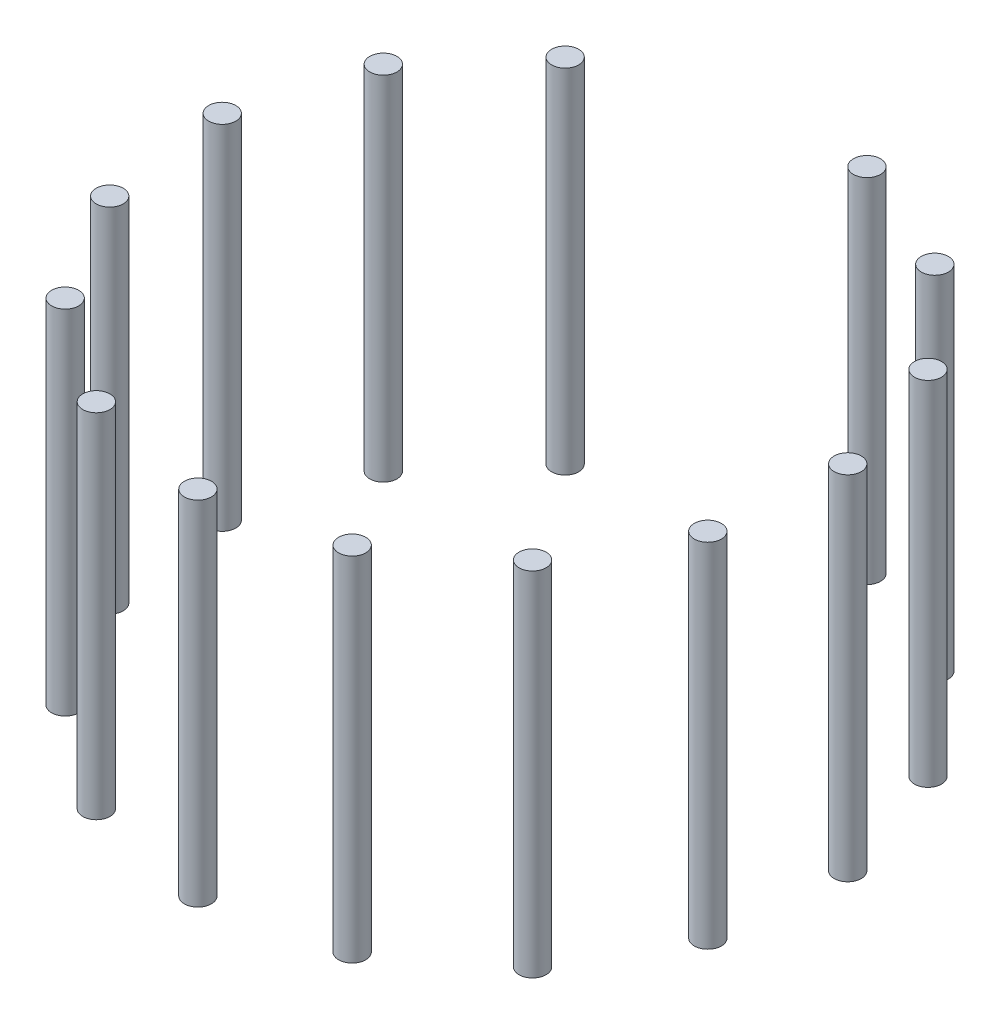
from build123d import *

# Parameters (mm, degrees)
SKETCH1_R              = 0.35
BOSS_EXTRUDE1_DEPTH    = 9.1
BOSS_EXTRUDE1_2_DEPTH  = 9.1
BOSS_EXTRUDE1_3_DEPTH  = 9.1
BOSS_EXTRUDE1_4_DEPTH  = 9.1
BOSS_EXTRUDE1_5_DEPTH  = 9.1
BOSS_EXTRUDE1_6_DEPTH  = 9.1
BOSS_EXTRUDE1_7_DEPTH  = 9.1
BOSS_EXTRUDE1_8_DEPTH  = 9.1
BOSS_EXTRUDE1_9_DEPTH  = 9.1
BOSS_EXTRUDE1_10_DEPTH = 9.1
BOSS_EXTRUDE1_11_DEPTH = 9.1
BOSS_EXTRUDE1_12_DEPTH = 9.1
BOSS_EXTRUDE1_13_DEPTH = 9.1
BOSS_EXTRUDE1_14_DEPTH = 9.1


with BuildPart() as part:
    # Sketch1 → Boss-Extrude1 (new body)
    with BuildSketch(Plane(origin=(0, 0, 0), x_dir=(1, 0, 0), z_dir=(0, 1, 0))):
        with Locations(Location((14.989749072, 9.164731075, 0), (0, 0, 270))):
            Circle(SKETCH1_R)
    extrude(amount=BOSS_EXTRUDE1_DEPTH)


with BuildPart() as body_2:
    # Sketch1 → Boss-Extrude1 2 (new body)
    with BuildSketch(Plane(origin=(0, 0, 0), x_dir=(1, 0, 0), z_dir=(0, 1, 0))):
        with Locations(Location((18.048638255, 7.857299093, 0), (0, 0, 270))):
            Circle(SKETCH1_R)
    extrude(amount=BOSS_EXTRUDE1_2_DEPTH)


with BuildPart() as body_3:
    # Sketch1 → Boss-Extrude1 3 (new body)
    with BuildSketch(Plane(origin=(0, 0, 0), x_dir=(1, 0, 0), z_dir=(0, 1, 0))):
        with Locations(Location((20.311292078, 5.418738227, 0), (0, 0, 270))):
            Circle(SKETCH1_R)
    extrude(amount=BOSS_EXTRUDE1_3_DEPTH)


with BuildPart() as body_4:
    # Sketch1 → Boss-Extrude1 4 (new body)
    with BuildSketch(Plane(origin=(0, 0, 0), x_dir=(1, 0, 0), z_dir=(0, 1, 0))):
        with Locations(Location((21.38647714, 2.270697804, 0), (0, 0, 270))):
            Circle(SKETCH1_R)
    extrude(amount=BOSS_EXTRUDE1_4_DEPTH)


with BuildPart() as body_5:
    # Sketch1 → Boss-Extrude1 5 (new body)
    with BuildSketch(Plane(origin=(0, 0, 0), x_dir=(1, 0, 0), z_dir=(0, 1, 0))):
        with Locations(Location((21.088284176, -1.042497388, 0), (0, 0, 270))):
            Circle(SKETCH1_R)
    extrude(amount=BOSS_EXTRUDE1_5_DEPTH)


with BuildPart() as body_6:
    # Sketch1 → Boss-Extrude1 6 (new body)
    with BuildSketch(Plane(origin=(0, 0, 0), x_dir=(1, 0, 0), z_dir=(0, 1, 0))):
        with Locations(Location((19.468273457, -3.9479658, 0), (0, 0, 270))):
            Circle(SKETCH1_R)
    extrude(amount=BOSS_EXTRUDE1_6_DEPTH)


with BuildPart() as body_7:
    # Sketch1 → Boss-Extrude1 7 (new body)
    with BuildSketch(Plane(origin=(0, 0, 0), x_dir=(1, 0, 0), z_dir=(0, 1, 0))):
        with Locations(Location((16.806559556, -5.943325549, 0), (0, 0, 270))):
            Circle(SKETCH1_R)
    extrude(amount=BOSS_EXTRUDE1_7_DEPTH)


with BuildPart() as body_8:
    # Sketch1 → Boss-Extrude1 8 (new body)
    with BuildSketch(Plane(origin=(0, 0, 0), x_dir=(1, 0, 0), z_dir=(0, 1, 0))):
        with Locations(Location((13.563376986, -6.683560807, 0), (0, 0, 270))):
            Circle(SKETCH1_R)
    extrude(amount=BOSS_EXTRUDE1_8_DEPTH)


with BuildPart() as body_9:
    # Sketch1 → Boss-Extrude1 9 (new body)
    with BuildSketch(Plane(origin=(0, 0, 0), x_dir=(1, 0, 0), z_dir=(0, 1, 0))):
        with Locations(Location((10.299501476, -6.040678173, 0), (0, 0, 270))):
            Circle(SKETCH1_R)
    extrude(amount=BOSS_EXTRUDE1_9_DEPTH)


with BuildPart() as body_10:
    # Sketch1 → Boss-Extrude1 10 (new body)
    with BuildSketch(Plane(origin=(0, 0, 0), x_dir=(1, 0, 0), z_dir=(0, 1, 0))):
        with Locations(Location((7.579286755, -4.125837895, 0), (0, 0, 270))):
            Circle(SKETCH1_R)
    extrude(amount=BOSS_EXTRUDE1_10_DEPTH)


with BuildPart() as body_11:
    # Sketch1 → Boss-Extrude1 11 (new body)
    with BuildSketch(Plane(origin=(0, 0, 0), x_dir=(1, 0, 0), z_dir=(0, 1, 0))):
        with Locations(Location((5.873082659, -1.270133252, 0), (0, 0, 270))):
            Circle(SKETCH1_R)
    extrude(amount=BOSS_EXTRUDE1_11_DEPTH)


with BuildPart() as body_12:
    # Sketch1 → Boss-Extrude1 12 (new body)
    with BuildSketch(Plane(origin=(0, 0, 0), x_dir=(1, 0, 0), z_dir=(0, 1, 0))):
        with Locations(Location((5.475907377, 2.032658479, 0), (0, 0, 270))):
            Circle(SKETCH1_R)
    extrude(amount=BOSS_EXTRUDE1_12_DEPTH)


with BuildPart() as body_13:
    # Sketch1 → Boss-Extrude1 13 (new body)
    with BuildSketch(Plane(origin=(0, 0, 0), x_dir=(1, 0, 0), z_dir=(0, 1, 0))):
        with Locations(Location((6.456436124, 5.211454603, 0), (0, 0, 270))):
            Circle(SKETCH1_R)
    extrude(amount=BOSS_EXTRUDE1_13_DEPTH)


with BuildPart() as body_14:
    # Sketch1 → Boss-Extrude1 14 (new body)
    with BuildSketch(Plane(origin=(0, 0, 0), x_dir=(1, 0, 0), z_dir=(0, 1, 0))):
        with Locations(Location((8.645126572, 7.716612391, 0), (0, 0, 270))):
            Circle(SKETCH1_R)
    extrude(amount=BOSS_EXTRUDE1_14_DEPTH)


solid = Compound([part.part, body_2.part, body_3.part, body_4.part, body_5.part, body_6.part, body_7.part, body_8.part, body_9.part, body_10.part, body_11.part, body_12.part, body_13.part, body_14.part])
